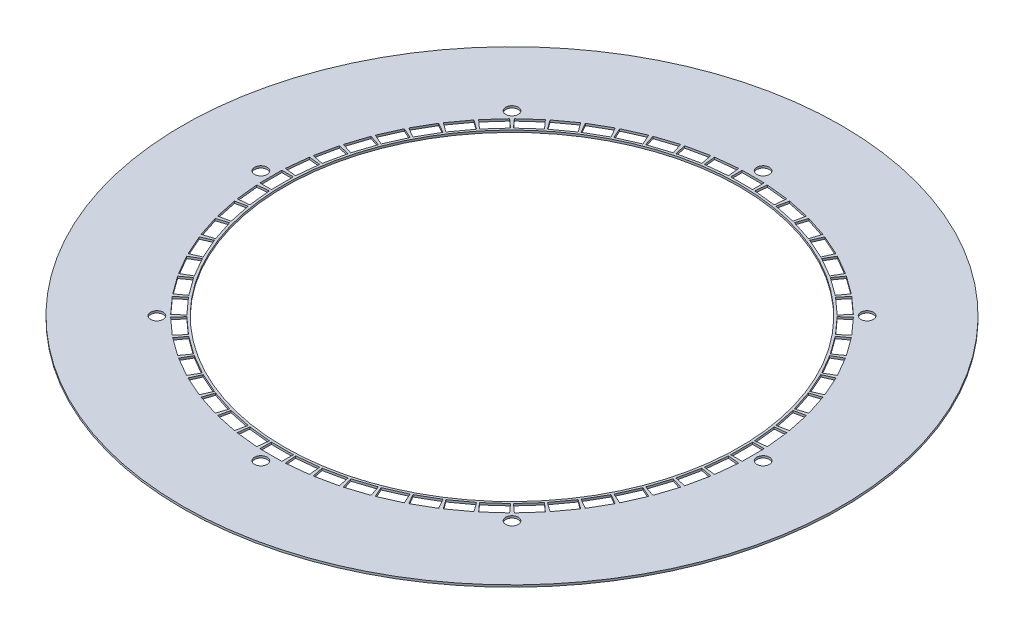
from build123d import *

# Parameters (mm, degrees)
SKETCH1_R           = 315
SKETCH1_R_2         = 217.5
SKETCH1_R_3         = 6
SKETCH1_W           = 21
SKETCH1_H           = 11
SKETCH1_W_2         = 11
SKETCH1_H_2         = 21
BOSS_EXTRUDE1_DEPTH = 1


with BuildPart() as part:
    # Sketch1 → Boss-Extrude1 (new, symmetric)
    with BuildSketch(Plane(origin=(0, 0, 0), x_dir=(1, 0, 0), z_dir=(0, 1, 0))):
        with Locations(Location((0, 0, 0), (0, 0, 270))):
            Circle(SKETCH1_R)
        with Locations(Location((0, 0, 0), (0, 0, 270))):
            Circle(SKETCH1_R_2, mode=Mode.SUBTRACT)
        with Locations(Location((0, 240, 0), (0, 0, 270))):
            Circle(SKETCH1_R_3, mode=Mode.SUBTRACT)
        with Locations(Location((169.705627485, 169.705627485, 0), (0, 0, 270))):
            Circle(SKETCH1_R_3, mode=Mode.SUBTRACT)
        with Locations(Location((240, 0, 0), (0, 0, 270))):
            Circle(SKETCH1_R_3, mode=Mode.SUBTRACT)
        with Locations(Location((169.705627485, -169.705627485, 0), (0, 0, 270))):
            Circle(SKETCH1_R_3, mode=Mode.SUBTRACT)
        with Locations(Location((0, -240, 0), (0, 0, 270))):
            Circle(SKETCH1_R_3, mode=Mode.SUBTRACT)
        with Locations(Location((-169.705627485, -169.705627485, 0), (0, 0, 270))):
            Circle(SKETCH1_R_3, mode=Mode.SUBTRACT)
        with Locations(Location((-240, 0, 0), (0, 0, 270))):
            Circle(SKETCH1_R_3, mode=Mode.SUBTRACT)
        with Locations(Location((-169.705627485, 169.705627485, 0), (0, 0, 270))):
            Circle(SKETCH1_R_3, mode=Mode.SUBTRACT)
        Polygon((13.651330882, 230.334845747), (12.501517786, 219.395104898), (33.386477589, 217.200007169), (34.536290685, 228.139748018), align=None, mode=Mode.SUBTRACT)
        with Locations((0, 225)):
            Rectangle(SKETCH1_W, SKETCH1_H, mode=Mode.SUBTRACT)
        Polygon((37.653094926, 227.646094723), (35.366066327, 216.886471115), (55.907165942, 212.520325607), (58.194194541, 223.279949216), align=None, mode=Mode.SUBTRACT)
        Polygon((61.242323782, 222.463205447), (57.843136844, 212.001583768), (77.815323686, 205.512226886), (81.214510625, 215.973848565), align=None, mode=Mode.SUBTRACT)
        Polygon((84.160568924, 214.842962739), (79.68646585, 204.793962705), (98.87092046, 196.2524932), (103.345023534, 206.301493234), align=None, mode=Mode.SUBTRACT)
        Polygon((106.15673326, 204.868855572), (100.65673326, 195.342576131), (118.84326674, 184.842576131), (124.34326674, 194.368855572), align=None, mode=Mode.SUBTRACT)
        Polygon((126.989822212, 192.650162352), (120.524184437, 183.750975414), (137.513541319, 171.407485116), (143.979179094, 180.306672054), align=None, mode=Mode.SUBTRACT)
        Polygon((146.431584098, 178.320753639), (139.071147428, 170.146160559), (154.677188763, 156.094417826), (162.037625433, 164.269010906), align=None, mode=Mode.SUBTRACT)
        Polygon((164.269010906, 162.037625433), (156.094417826, 154.677188763), (170.146160559, 139.071147428), (178.320753639, 146.431584098), align=None, mode=Mode.SUBTRACT)
        Polygon((180.306672054, 143.979179094), (171.407485116, 137.513541319), (183.750975414, 120.524184437), (192.650162352, 126.989822212), align=None, mode=Mode.SUBTRACT)
        Polygon((194.368855572, 124.34326674), (184.842576131, 118.84326674), (195.342576131, 100.65673326), (204.868855572, 106.15673326), align=None, mode=Mode.SUBTRACT)
        Polygon((206.301493234, 103.345023534), (196.2524932, 98.87092046), (204.793962705, 79.68646585), (214.842962739, 84.160568924), align=None, mode=Mode.SUBTRACT)
        Polygon((215.973848565, 81.214510625), (205.512226886, 77.815323686), (212.001583768, 57.843136844), (222.463205447, 61.242323782), align=None, mode=Mode.SUBTRACT)
        Polygon((223.279949216, 58.194194541), (212.520325607, 55.907165942), (216.886471115, 35.366066327), (227.646094723, 37.653094926), align=None, mode=Mode.SUBTRACT)
        Polygon((228.139748018, 34.536290685), (217.200007169, 33.386477589), (219.395104898, 12.501517786), (230.334845747, 13.651330882), align=None, mode=Mode.SUBTRACT)
        with Locations((225, 0)):
            Rectangle(SKETCH1_W_2, SKETCH1_H_2, mode=Mode.SUBTRACT)
        Polygon((230.334845747, -13.651330882), (219.395104898, -12.501517786), (217.200007169, -33.386477589), (228.139748018, -34.536290685), align=None, mode=Mode.SUBTRACT)
        Polygon((227.646094723, -37.653094926), (216.886471115, -35.366066327), (212.520325607, -55.907165942), (223.279949216, -58.194194541), align=None, mode=Mode.SUBTRACT)
        Polygon((222.463205447, -61.242323782), (212.001583768, -57.843136844), (205.512226886, -77.815323686), (215.973848565, -81.214510625), align=None, mode=Mode.SUBTRACT)
        Polygon((214.842962739, -84.160568924), (204.793962705, -79.68646585), (196.2524932, -98.87092046), (206.301493234, -103.345023534), align=None, mode=Mode.SUBTRACT)
        Polygon((204.868855572, -106.15673326), (195.342576131, -100.65673326), (184.842576131, -118.84326674), (194.368855572, -124.34326674), align=None, mode=Mode.SUBTRACT)
        Polygon((192.650162352, -126.989822212), (183.750975414, -120.524184437), (171.407485116, -137.513541319), (180.306672054, -143.979179094), align=None, mode=Mode.SUBTRACT)
        Polygon((178.320753639, -146.431584098), (170.146160559, -139.071147428), (156.094417826, -154.677188763), (164.269010906, -162.037625433), align=None, mode=Mode.SUBTRACT)
        Polygon((162.037625433, -164.269010906), (154.677188763, -156.094417826), (139.071147428, -170.146160559), (146.431584098, -178.320753639), align=None, mode=Mode.SUBTRACT)
        Polygon((143.979179094, -180.306672054), (137.513541319, -171.407485116), (120.524184437, -183.750975414), (126.989822212, -192.650162352), align=None, mode=Mode.SUBTRACT)
        Polygon((124.34326674, -194.368855572), (118.84326674, -184.842576131), (100.65673326, -195.342576131), (106.15673326, -204.868855572), align=None, mode=Mode.SUBTRACT)
        Polygon((103.345023534, -206.301493234), (98.87092046, -196.2524932), (79.68646585, -204.793962705), (84.160568924, -214.842962739), align=None, mode=Mode.SUBTRACT)
        Polygon((81.214510625, -215.973848565), (77.815323686, -205.512226886), (57.843136844, -212.001583768), (61.242323782, -222.463205447), align=None, mode=Mode.SUBTRACT)
        Polygon((58.194194541, -223.279949216), (55.907165942, -212.520325607), (35.366066327, -216.886471115), (37.653094926, -227.646094723), align=None, mode=Mode.SUBTRACT)
        Polygon((34.536290685, -228.139748018), (33.386477589, -217.200007169), (12.501517786, -219.395104898), (13.651330882, -230.334845747), align=None, mode=Mode.SUBTRACT)
        with Locations((0, -225)):
            Rectangle(SKETCH1_W, SKETCH1_H, mode=Mode.SUBTRACT)
        Polygon((-13.651330882, -230.334845747), (-12.501517786, -219.395104898), (-33.386477589, -217.200007169), (-34.536290685, -228.139748018), align=None, mode=Mode.SUBTRACT)
        Polygon((-37.653094926, -227.646094723), (-35.366066327, -216.886471115), (-55.907165942, -212.520325607), (-58.194194541, -223.279949216), align=None, mode=Mode.SUBTRACT)
        Polygon((-61.242323782, -222.463205447), (-57.843136844, -212.001583768), (-77.815323686, -205.512226886), (-81.214510625, -215.973848565), align=None, mode=Mode.SUBTRACT)
        Polygon((-84.160568924, -214.842962739), (-79.68646585, -204.793962705), (-98.87092046, -196.2524932), (-103.345023534, -206.301493234), align=None, mode=Mode.SUBTRACT)
        Polygon((-106.15673326, -204.868855572), (-100.65673326, -195.342576131), (-118.84326674, -184.842576131), (-124.34326674, -194.368855572), align=None, mode=Mode.SUBTRACT)
        Polygon((-126.989822212, -192.650162352), (-120.524184437, -183.750975414), (-137.513541319, -171.407485116), (-143.979179094, -180.306672054), align=None, mode=Mode.SUBTRACT)
        Polygon((-146.431584098, -178.320753639), (-139.071147428, -170.146160559), (-154.677188763, -156.094417826), (-162.037625433, -164.269010906), align=None, mode=Mode.SUBTRACT)
        Polygon((-164.269010906, -162.037625433), (-156.094417826, -154.677188763), (-170.146160559, -139.071147428), (-178.320753639, -146.431584098), align=None, mode=Mode.SUBTRACT)
        Polygon((-180.306672054, -143.979179094), (-171.407485116, -137.513541319), (-183.750975414, -120.524184437), (-192.650162352, -126.989822212), align=None, mode=Mode.SUBTRACT)
        Polygon((-194.368855572, -124.34326674), (-184.842576131, -118.84326674), (-195.342576131, -100.65673326), (-204.868855572, -106.15673326), align=None, mode=Mode.SUBTRACT)
        Polygon((-206.301493234, -103.345023534), (-196.2524932, -98.87092046), (-204.793962705, -79.68646585), (-214.842962739, -84.160568924), align=None, mode=Mode.SUBTRACT)
        Polygon((-215.973848565, -81.214510625), (-205.512226886, -77.815323686), (-212.001583768, -57.843136844), (-222.463205447, -61.242323782), align=None, mode=Mode.SUBTRACT)
        Polygon((-223.279949216, -58.194194541), (-212.520325607, -55.907165942), (-216.886471115, -35.366066327), (-227.646094723, -37.653094926), align=None, mode=Mode.SUBTRACT)
        Polygon((-228.139748018, -34.536290685), (-217.200007169, -33.386477589), (-219.395104898, -12.501517786), (-230.334845747, -13.651330882), align=None, mode=Mode.SUBTRACT)
        with Locations((-225, 0)):
            Rectangle(SKETCH1_W_2, SKETCH1_H_2, mode=Mode.SUBTRACT)
        Polygon((-230.334845747, 13.651330882), (-219.395104898, 12.501517786), (-217.200007169, 33.386477589), (-228.139748018, 34.536290685), align=None, mode=Mode.SUBTRACT)
        Polygon((-227.646094723, 37.653094926), (-216.886471115, 35.366066327), (-212.520325607, 55.907165942), (-223.279949216, 58.194194541), align=None, mode=Mode.SUBTRACT)
        Polygon((-222.463205447, 61.242323782), (-212.001583768, 57.843136844), (-205.512226886, 77.815323686), (-215.973848565, 81.214510625), align=None, mode=Mode.SUBTRACT)
        Polygon((-214.842962739, 84.160568924), (-204.793962705, 79.68646585), (-196.2524932, 98.87092046), (-206.301493234, 103.345023534), align=None, mode=Mode.SUBTRACT)
        Polygon((-204.868855572, 106.15673326), (-195.342576131, 100.65673326), (-184.842576131, 118.84326674), (-194.368855572, 124.34326674), align=None, mode=Mode.SUBTRACT)
        Polygon((-192.650162352, 126.989822212), (-183.750975414, 120.524184437), (-171.407485116, 137.513541319), (-180.306672054, 143.979179094), align=None, mode=Mode.SUBTRACT)
        Polygon((-178.320753639, 146.431584098), (-170.146160559, 139.071147428), (-156.094417826, 154.677188763), (-164.269010906, 162.037625433), align=None, mode=Mode.SUBTRACT)
        Polygon((-162.037625433, 164.269010906), (-154.677188763, 156.094417826), (-139.071147428, 170.146160559), (-146.431584098, 178.320753639), align=None, mode=Mode.SUBTRACT)
        Polygon((-143.979179094, 180.306672054), (-137.513541319, 171.407485116), (-120.524184437, 183.750975414), (-126.989822212, 192.650162352), align=None, mode=Mode.SUBTRACT)
        Polygon((-124.34326674, 194.368855572), (-118.84326674, 184.842576131), (-100.65673326, 195.342576131), (-106.15673326, 204.868855572), align=None, mode=Mode.SUBTRACT)
        Polygon((-103.345023534, 206.301493234), (-98.87092046, 196.2524932), (-79.68646585, 204.793962705), (-84.160568924, 214.842962739), align=None, mode=Mode.SUBTRACT)
        Polygon((-81.214510625, 215.973848565), (-77.815323686, 205.512226886), (-57.843136844, 212.001583768), (-61.242323782, 222.463205447), align=None, mode=Mode.SUBTRACT)
        Polygon((-58.194194541, 223.279949216), (-55.907165942, 212.520325607), (-35.366066327, 216.886471115), (-37.653094926, 227.646094723), align=None, mode=Mode.SUBTRACT)
        Polygon((-34.536290685, 228.139748018), (-33.386477589, 217.200007169), (-12.501517786, 219.395104898), (-13.651330882, 230.334845747), align=None, mode=Mode.SUBTRACT)
    extrude(amount=BOSS_EXTRUDE1_DEPTH, both=True)


solid = part.part
